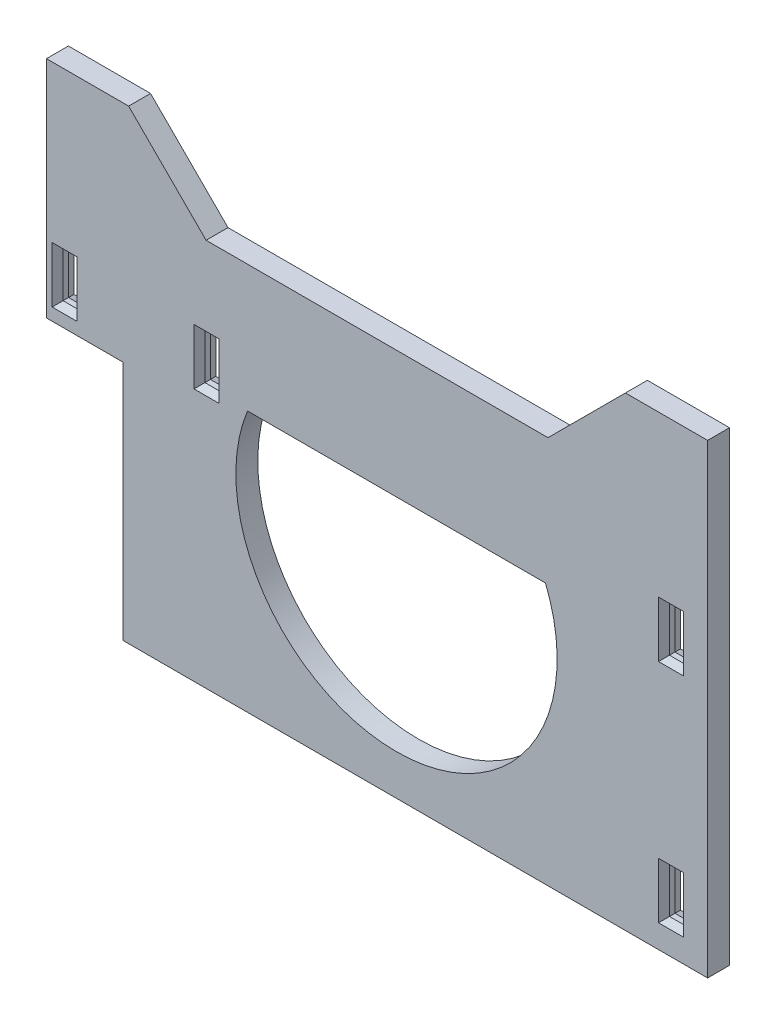
from build123d import *
from OCP.BRepFilletAPI import BRepFilletAPI_MakeChamfer

# Parameters (mm, degrees)
SKETCH1_W           = 3.53
SKETCH1_H           = 9.2
BOSS_EXTRUDE1_DEPTH = 4
BOSS_EXTRUDE2_DEPTH = 4
CHAMFER1_SIZE       = 1.5
CHAMFER1_SIZE2      = 0.5
CHAMFER2_SIZE       = 0.5
CHAMFER2_SIZE2      = 1.5


with BuildPart() as part:
    # Sketch1 → Boss-Extrude1 (new body)
    with BuildSketch(Plane.XY):
        Polygon((52.4925, 30), (52.4925, -30), (-54.2075, -30), (-54.2075, 14), (-68.2075, 14), (-68.2075, 30), align=None)
        with BuildLine():
            Line((-31.510630119, 17.647843267), (22.89855475, 17.647843267))
            ThreePointArc((22.89855475, 17.647843267), (-4.306037684, -22.627990687), (-31.510630119, 17.647843267))
        make_face(mode=Mode.SUBTRACT)
        with Locations((-39.0075, 21.35)):
            Rectangle(SKETCH1_W, SKETCH1_H, mode=Mode.SUBTRACT)
        with Locations((45.7925, 20.65)):
            Rectangle(SKETCH1_W, SKETCH1_H, mode=Mode.SUBTRACT)
        with Locations((45.8, -20.65)):
            Rectangle(SKETCH1_W, SKETCH1_H, mode=Mode.SUBTRACT)
        with Locations((-64.9075, 21.35)):
            Rectangle(SKETCH1_W, SKETCH1_H, mode=Mode.SUBTRACT)
    extrude(amount=BOSS_EXTRUDE1_DEPTH)

    # Sketch2 → Boss-Extrude2 (add)
    with BuildSketch(Plane.XY):
        Polygon((-68.2075, 30), (52.4925, 30), (52.4925, 55), (37.4925, 55), (23.350364376, 40.857864376), (-39.065364376, 40.857864376), (-53.2075, 55), (-68.2075, 55), align=None)
    extrude(amount=BOSS_EXTRUDE2_DEPTH)

    # Chamfer1: one chamfer whose edges measure the first distance from different faces: ONE call of the kernel's chamfer builder (chamfer() names one face for all edges)
    chamfer1_edges_1 = [part.edges().sort_by_distance(p)[0] for p in [
        (-40.7725, 21.35, 0),
    ]]
    chamfer1_side_1 = [part.faces().sort_by_distance(p)[0] for p in [
        (-40.7725, 21.35, 2),
    ]]
    chamfer1_edges_2 = [part.edges().sort_by_distance(p)[0] for p in [
        (-39.0075, 16.75, 0),
    ]]
    chamfer1_side_2 = [part.faces().sort_by_distance(p)[0] for p in [
        (-39.0075, 16.75, 2),
    ]]
    chamfer1_edges_3 = [part.edges().sort_by_distance(p)[0] for p in [
        (-37.2425, 21.35, 0),
    ]]
    chamfer1_side_3 = [part.faces().sort_by_distance(p)[0] for p in [
        (-37.2425, 21.35, 2),
    ]]
    chamfer1_edges_4 = [part.edges().sort_by_distance(p)[0] for p in [
        (-39.0075, 25.95, 0),
    ]]
    chamfer1_side_4 = [part.faces().sort_by_distance(p)[0] for p in [
        (-39.0075, 25.95, 2),
    ]]
    chamfer1_edges_5 = [part.edges().sort_by_distance(p)[0] for p in [
        (-66.6725, 21.35, 0),
    ]]
    chamfer1_side_5 = [part.faces().sort_by_distance(p)[0] for p in [
        (-66.6725, 21.35, 2),
    ]]
    chamfer1_edges_6 = [part.edges().sort_by_distance(p)[0] for p in [
        (-64.9075, 16.75, 0),
    ]]
    chamfer1_side_6 = [part.faces().sort_by_distance(p)[0] for p in [
        (-64.9075, 16.75, 2),
    ]]
    chamfer1_edges_7 = [part.edges().sort_by_distance(p)[0] for p in [
        (-63.1425, 21.35, 0),
    ]]
    chamfer1_side_7 = [part.faces().sort_by_distance(p)[0] for p in [
        (-63.1425, 21.35, 2),
    ]]
    chamfer1_edges_8 = [part.edges().sort_by_distance(p)[0] for p in [
        (-64.9075, 25.95, 0),
    ]]
    chamfer1_side_8 = [part.faces().sort_by_distance(p)[0] for p in [
        (-64.9075, 25.95, 2),
    ]]
    chamfer1_edges_9 = [part.edges().sort_by_distance(p)[0] for p in [
        (44.0275, 20.65, 0),
    ]]
    chamfer1_side_9 = [part.faces().sort_by_distance(p)[0] for p in [
        (44.0275, 20.65, 2),
    ]]
    chamfer1_edges_10 = [part.edges().sort_by_distance(p)[0] for p in [
        (45.7925, 16.05, 0),
    ]]
    chamfer1_side_10 = [part.faces().sort_by_distance(p)[0] for p in [
        (45.7925, 16.05, 2),
    ]]
    chamfer1_edges_11 = [part.edges().sort_by_distance(p)[0] for p in [
        (47.5575, 20.65, 0),
    ]]
    chamfer1_side_11 = [part.faces().sort_by_distance(p)[0] for p in [
        (47.5575, 20.65, 2),
    ]]
    chamfer1_edges_12 = [part.edges().sort_by_distance(p)[0] for p in [
        (45.7925, 25.25, 0),
    ]]
    chamfer1_side_12 = [part.faces().sort_by_distance(p)[0] for p in [
        (45.7925, 25.25, 2),
    ]]
    chamfer1_edges_13 = [part.edges().sort_by_distance(p)[0] for p in [
        (47.565, -20.65, 0),
    ]]
    chamfer1_side_13 = [part.faces().sort_by_distance(p)[0] for p in [
        (47.565, -20.65, 2),
    ]]
    chamfer1_edges_14 = [part.edges().sort_by_distance(p)[0] for p in [
        (45.8, -16.05, 0),
    ]]
    chamfer1_side_14 = [part.faces().sort_by_distance(p)[0] for p in [
        (45.8, -16.05, 2),
    ]]
    chamfer1_edges_15 = [part.edges().sort_by_distance(p)[0] for p in [
        (44.035, -20.65, 0),
    ]]
    chamfer1_side_15 = [part.faces().sort_by_distance(p)[0] for p in [
        (44.035, -20.65, 2),
    ]]
    chamfer1_edges_16 = [part.edges().sort_by_distance(p)[0] for p in [
        (45.8, -25.25, 0),
    ]]
    chamfer1_side_16 = [part.faces().sort_by_distance(p)[0] for p in [
        (45.8, -25.25, 2),
    ]]
    chamfer1 = BRepFilletAPI_MakeChamfer(part.part.solid().wrapped)
    for e in chamfer1_edges_1:
        chamfer1.Add(CHAMFER1_SIZE, CHAMFER1_SIZE2, e.wrapped, chamfer1_side_1[0].wrapped)  # the first distance lies on this face
    for e in chamfer1_edges_2:
        chamfer1.Add(CHAMFER1_SIZE, CHAMFER1_SIZE2, e.wrapped, chamfer1_side_2[0].wrapped)  # the first distance lies on this face
    for e in chamfer1_edges_3:
        chamfer1.Add(CHAMFER1_SIZE, CHAMFER1_SIZE2, e.wrapped, chamfer1_side_3[0].wrapped)  # the first distance lies on this face
    for e in chamfer1_edges_4:
        chamfer1.Add(CHAMFER1_SIZE, CHAMFER1_SIZE2, e.wrapped, chamfer1_side_4[0].wrapped)  # the first distance lies on this face
    for e in chamfer1_edges_5:
        chamfer1.Add(CHAMFER1_SIZE, CHAMFER1_SIZE2, e.wrapped, chamfer1_side_5[0].wrapped)  # the first distance lies on this face
    for e in chamfer1_edges_6:
        chamfer1.Add(CHAMFER1_SIZE, CHAMFER1_SIZE2, e.wrapped, chamfer1_side_6[0].wrapped)  # the first distance lies on this face
    for e in chamfer1_edges_7:
        chamfer1.Add(CHAMFER1_SIZE, CHAMFER1_SIZE2, e.wrapped, chamfer1_side_7[0].wrapped)  # the first distance lies on this face
    for e in chamfer1_edges_8:
        chamfer1.Add(CHAMFER1_SIZE, CHAMFER1_SIZE2, e.wrapped, chamfer1_side_8[0].wrapped)  # the first distance lies on this face
    for e in chamfer1_edges_9:
        chamfer1.Add(CHAMFER1_SIZE, CHAMFER1_SIZE2, e.wrapped, chamfer1_side_9[0].wrapped)  # the first distance lies on this face
    for e in chamfer1_edges_10:
        chamfer1.Add(CHAMFER1_SIZE, CHAMFER1_SIZE2, e.wrapped, chamfer1_side_10[0].wrapped)  # the first distance lies on this face
    for e in chamfer1_edges_11:
        chamfer1.Add(CHAMFER1_SIZE, CHAMFER1_SIZE2, e.wrapped, chamfer1_side_11[0].wrapped)  # the first distance lies on this face
    for e in chamfer1_edges_12:
        chamfer1.Add(CHAMFER1_SIZE, CHAMFER1_SIZE2, e.wrapped, chamfer1_side_12[0].wrapped)  # the first distance lies on this face
    for e in chamfer1_edges_13:
        chamfer1.Add(CHAMFER1_SIZE, CHAMFER1_SIZE2, e.wrapped, chamfer1_side_13[0].wrapped)  # the first distance lies on this face
    for e in chamfer1_edges_14:
        chamfer1.Add(CHAMFER1_SIZE, CHAMFER1_SIZE2, e.wrapped, chamfer1_side_14[0].wrapped)  # the first distance lies on this face
    for e in chamfer1_edges_15:
        chamfer1.Add(CHAMFER1_SIZE, CHAMFER1_SIZE2, e.wrapped, chamfer1_side_15[0].wrapped)  # the first distance lies on this face
    for e in chamfer1_edges_16:
        chamfer1.Add(CHAMFER1_SIZE, CHAMFER1_SIZE2, e.wrapped, chamfer1_side_16[0].wrapped)  # the first distance lies on this face
    add(Compound.cast(chamfer1.Shape()), mode=Mode.REPLACE)

    # Chamfer2
    chamfer2_edges = [part.edges().sort_by_distance(p)[0] for p in [
        (-40.7725, 21.35, 4),
        (-39.0075, 16.75, 4),
        (-37.2425, 21.35, 4),
        (-39.0075, 25.95, 4),
        (-66.6725, 21.35, 4),
        (-64.9075, 16.75, 4),
        (-63.1425, 21.35, 4),
        (-64.9075, 25.95, 4),
        (44.0275, 20.65, 4),
        (45.7925, 16.05, 4),
        (47.5575, 20.65, 4),
        (45.7925, 25.25, 4),
        (47.565, -20.65, 4),
        (45.8, -16.05, 4),
        (44.035, -20.65, 4),
        (45.8, -25.25, 4),
    ]]
    chamfer2_side = [part.faces().sort_by_distance(p)[0] for p in [
        (-0.8575, -28.523738167, 4),
    ]]
    chamfer(chamfer2_edges, length=CHAMFER2_SIZE, length2=CHAMFER2_SIZE2, reference=chamfer2_side[0])


solid = part.part
